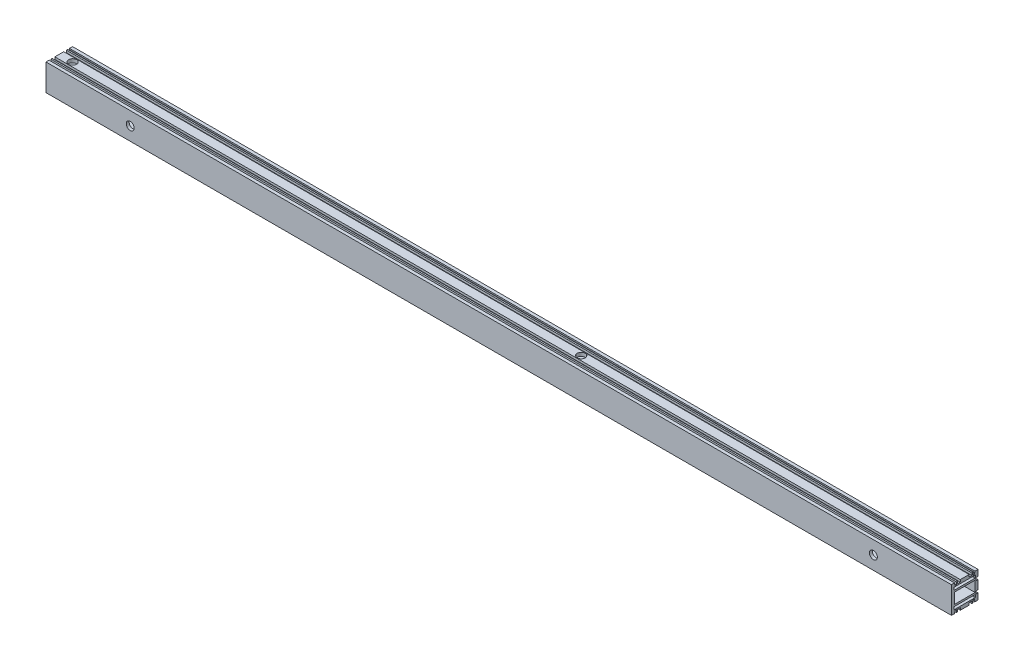
from build123d import *

# Parameters (mm, degrees)
SKETCH_1_W             = 23.5
SKETCH_1_H             = 12
EXTRUDE_1_DEPTH        = 510.5
HOLE_WIZARD_M6_1_D     = 5
HOLE_WIZARD_M6_1_DEPTH = 19
HOLE_WIZARD_M6_1_TIP   = 1.502151548
HOLE_WIZARD_M6_2_D     = 5
HOLE_WIZARD_M6_2_DEPTH = 19
HOLE_WIZARD_M6_2_TIP   = 1.502151548
SKETCH_6_R             = 4.5
CUT_EXTRUDE_1_DEPTH    = 512.600674355
SKETCH_7_R             = 4.5
CUT_EXTRUDE_2_DEPTH    = 512.600674355
HOLE_WIZARD_M4_1_D     = 3.3
HOLE_WIZARD_M4_1_DEPTH = 11.5
HOLE_WIZARD_M4_1_TIP   = 0.991420021


with BuildPart() as part:
    # 草图1 → 凸台-拉伸1 (new, symmetric)
    with BuildSketch(Plane(origin=(0, 0, 0), x_dir=(0, 0, -1), z_dir=(1, 0, 0))):
        Polygon((-15, 15), (-11.5, 15), (-11.5, 13.5), (-11, 13.5), (-11, 12), (-9.5, 12), (-9.5, 15), (-8, 15), (-8, 12.5), (-5, 12.5), (-5, 15), (5, 15), (5, 12.5), (8, 12.5), (8, 15), (9.5, 15), (9.5, 12), (11, 12), (11, 13.5), (11.5, 13.5), (11.5, 15), (15, 15), (15, 8), (12.5, 8), (12.5, 5), (15, 5), (15, -5), (12.5, -5), (12.5, -8), (15, -8), (15, -15), (11.5, -15), (11.5, -13.5), (11, -13.5), (11, -12), (9.5, -12), (9.5, -15), (8, -15), (8, -12.5), (5, -12.5), (5, -15), (-5, -15), (-5, -12.5), (-8, -12.5), (-8, -15), (-9.5, -15), (-9.5, -12), (-11, -12), (-11, -13.5), (-11.5, -13.5), (-11.5, -15), (-15, -15), align=None)
        with BuildLine():
            Line((12, -10.5), (12, -8.5))
            ThreePointArc((12, -8.5), (11.853553391, -8.146446609), (11.5, -8))
            Line((11.5, -8), (-11.5, -8))
            ThreePointArc((-11.5, -8), (-11.853553391, -8.146446609), (-12, -8.5))
            Line((-12, -8.5), (-12, -10.5))
            ThreePointArc((-12, -10.5), (-11.853553391, -10.853553391), (-11.5, -11))
            Line((-11.5, -11), (11.5, -11))
            ThreePointArc((11.5, -11), (11.853553391, -10.853553391), (12, -10.5))
        make_face(mode=Mode.SUBTRACT)
        with BuildLine():
            Line((-11.5, 11), (11.5, 11))
            ThreePointArc((11.5, 11), (11.853553391, 10.853553391), (12, 10.5))
            Line((12, 10.5), (12, 8.5))
            ThreePointArc((12, 8.5), (11.853553391, 8.146446609), (11.5, 8))
            Line((11.5, 8), (-11.5, 8))
            ThreePointArc((-11.5, 8), (-11.853553391, 8.146446609), (-12, 8.5))
            Line((-12, 8.5), (-12, 10.5))
            ThreePointArc((-12, 10.5), (-11.853553391, 10.853553391), (-11.5, 11))
        make_face(mode=Mode.SUBTRACT)
        Rectangle(SKETCH_1_W, SKETCH_1_H, mode=Mode.SUBTRACT)
    extrude(amount=EXTRUDE_1_DEPTH, both=True)

    # M6 螺纹孔1
    with Locations(Plane(origin=(0, -15, 0), x_dir=(-1, 0, 0), z_dir=(0, -1, 0))):
        with Locations((460.5, 0), (445.5, 0), (-133, 0), (-148, 0), (-218, 0), (-233, 0), (-445.5, 0), (-460.5, 0), (262.5, 0), (211.5, 0)):
            Hole(HOLE_WIZARD_M6_1_D / 2, depth=HOLE_WIZARD_M6_1_DEPTH)
            with Locations((0, 0, -(HOLE_WIZARD_M6_1_DEPTH + HOLE_WIZARD_M6_1_TIP / 2))):  # 118° drill point
                Cone(0, HOLE_WIZARD_M6_1_D / 2, HOLE_WIZARD_M6_1_TIP, mode=Mode.SUBTRACT)

    # M6 螺纹孔2
    with Locations(Plane(origin=(0, 0, -15), x_dir=(-1, 0, 0), z_dir=(0, 0, -1))):
        with Locations((460.5, 0), (445.5, 0), (157.5, 0), (142.5, 0), (-445.5, 0), (-460.5, 0)):
            Hole(HOLE_WIZARD_M6_2_D / 2, depth=HOLE_WIZARD_M6_2_DEPTH)
            with Locations((0, 0, -(HOLE_WIZARD_M6_2_DEPTH + HOLE_WIZARD_M6_2_TIP / 2))):  # 118° drill point
                Cone(0, HOLE_WIZARD_M6_2_D / 2, HOLE_WIZARD_M6_2_TIP, mode=Mode.SUBTRACT)

    # 草图6 → 切除-拉伸1 (cut, through all)
    with BuildSketch(Plane(origin=(0, 15, 0), x_dir=(1, 0, 0), z_dir=(0, 1, 0))):
        with Locations(Location((-495.5, 0, 0), (0, 0, 270))):
            Circle(SKETCH_6_R)
        with Locations(Location((78, 0, 0), (0, 0, 270))):
            Circle(SKETCH_6_R)
    extrude(amount=-CUT_EXTRUDE_1_DEPTH, mode=Mode.SUBTRACT)

    # 草图7 → 切除-拉伸2 (cut, through all)
    with BuildSketch(Plane.XY.offset(15)):
        with Locations((-415.5, 0)):
            Circle(SKETCH_7_R)
        with Locations((422.5, 0)):
            Circle(SKETCH_7_R)
    extrude(amount=-CUT_EXTRUDE_2_DEPTH, mode=Mode.SUBTRACT)

    # M4 螺纹孔1
    with Locations(Plane(origin=(0, 0, -15), x_dir=(-1, 0, 0), z_dir=(0, 0, -1))):
        with Locations((343.5, 0)):
            Hole(HOLE_WIZARD_M4_1_D / 2, depth=HOLE_WIZARD_M4_1_DEPTH)
            with Locations((0, 0, -(HOLE_WIZARD_M4_1_DEPTH + HOLE_WIZARD_M4_1_TIP / 2))):  # 118° drill point
                Cone(0, HOLE_WIZARD_M4_1_D / 2, HOLE_WIZARD_M4_1_TIP, mode=Mode.SUBTRACT)


solid = part.part
